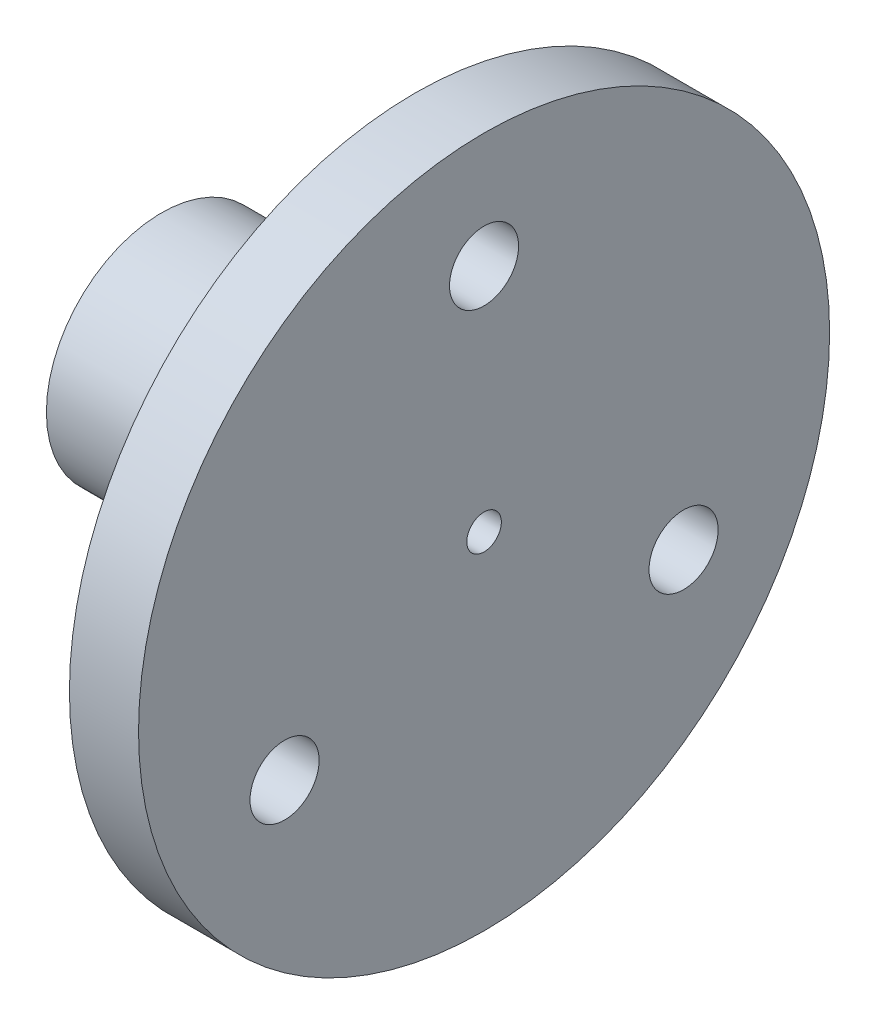
from build123d import *

# Parameters (mm, degrees)
SKETCH3_R          = 1.5
CUT_EXTRUDE1_DEPTH = 10
CIRPATTERN1_COUNT  = 3


with BuildPart() as part:
    # Sketch2 → Revolve1 (revolve)
    with BuildSketch(Plane.XY, mode=Mode.PRIVATE) as revolve1_sk:
        Polygon((14, 15), (11, 15), (11, 5), (0, 5), (0, 0.75), (14, 0.75), align=None)
    revolve(revolve1_sk.sketch.rotate(Axis((0, 0, 0), (1, 0, 0)), 90), axis=Axis((0, 0, 0), (1, 0, 0)))

    # Sketch3 → Cut-Extrude1 (cut)
    with BuildSketch(Plane.ZY.offset(-11)):
        with Locations((0, 10)):
            Circle(SKETCH3_R)
    cut_extrude1 = extrude(amount=-CUT_EXTRUDE1_DEPTH, mode=Mode.SUBTRACT)

    # CirPattern1: Cut-Extrude1 ×3 about axis
    cirpattern1_axis = Axis((0, 0, 0), (1, 0, 0))
    for i in range(1, CIRPATTERN1_COUNT):
        add(cut_extrude1.rotate(cirpattern1_axis, i * 360 / CIRPATTERN1_COUNT), mode=Mode.SUBTRACT)


solid = part.part
